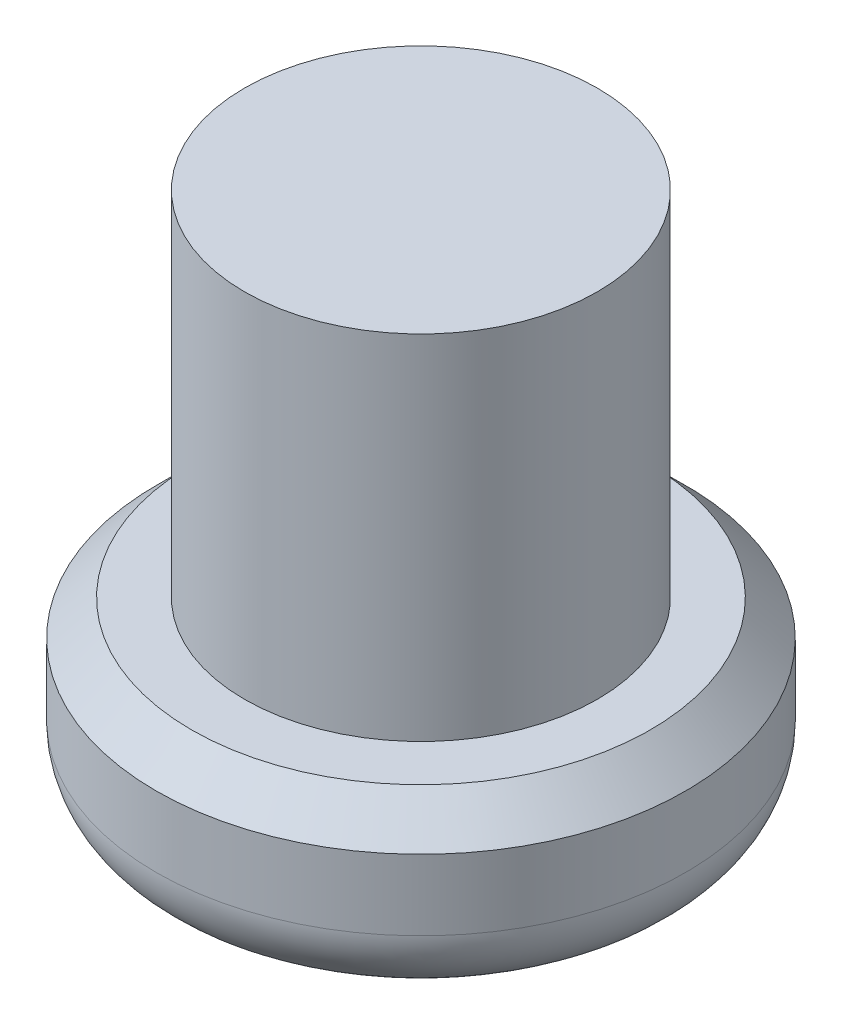
from build123d import *

# Parameters (mm, degrees)
SKETCH1_R           = 7.5
BOSS_EXTRUDE1_DEPTH = 5
FILLET1_R           = 2
SKETCH2_R           = 5
BOSS_EXTRUDE2_DEPTH = 10
CHAMFER2_SIZE       = 1


with BuildPart() as part:
    # Sketch1 → Boss-Extrude1 (new body)
    with BuildSketch(Plane(origin=(0, 0, 0), x_dir=(1, 0, 0), z_dir=(0, 1, 0))):
        with Locations(Location((0, 0, 0), (0, 0, 270))):
            Circle(SKETCH1_R)
    extrude(amount=BOSS_EXTRUDE1_DEPTH)

    # Fillet1
    fillet1_edges = [part.edges().sort_by_distance(p)[0] for p in [
        (0, 0, -7.5),
    ]]
    fillet(fillet1_edges, radius=FILLET1_R)

    # Sketch2 → Boss-Extrude2 (add)
    with BuildSketch(Plane(origin=(0, 5, 0), x_dir=(1, 0, 0), z_dir=(0, 1, 0))):
        with Locations(Location((0, 0, 0), (0, 0, 270))):
            Circle(SKETCH2_R)
    extrude(amount=BOSS_EXTRUDE2_DEPTH)

    # Chamfer2
    chamfer2_edges = [part.edges().sort_by_distance(p)[0] for p in [
        (0, 5, -7.5),
    ]]
    chamfer(chamfer2_edges, length=CHAMFER2_SIZE)


solid = part.part
